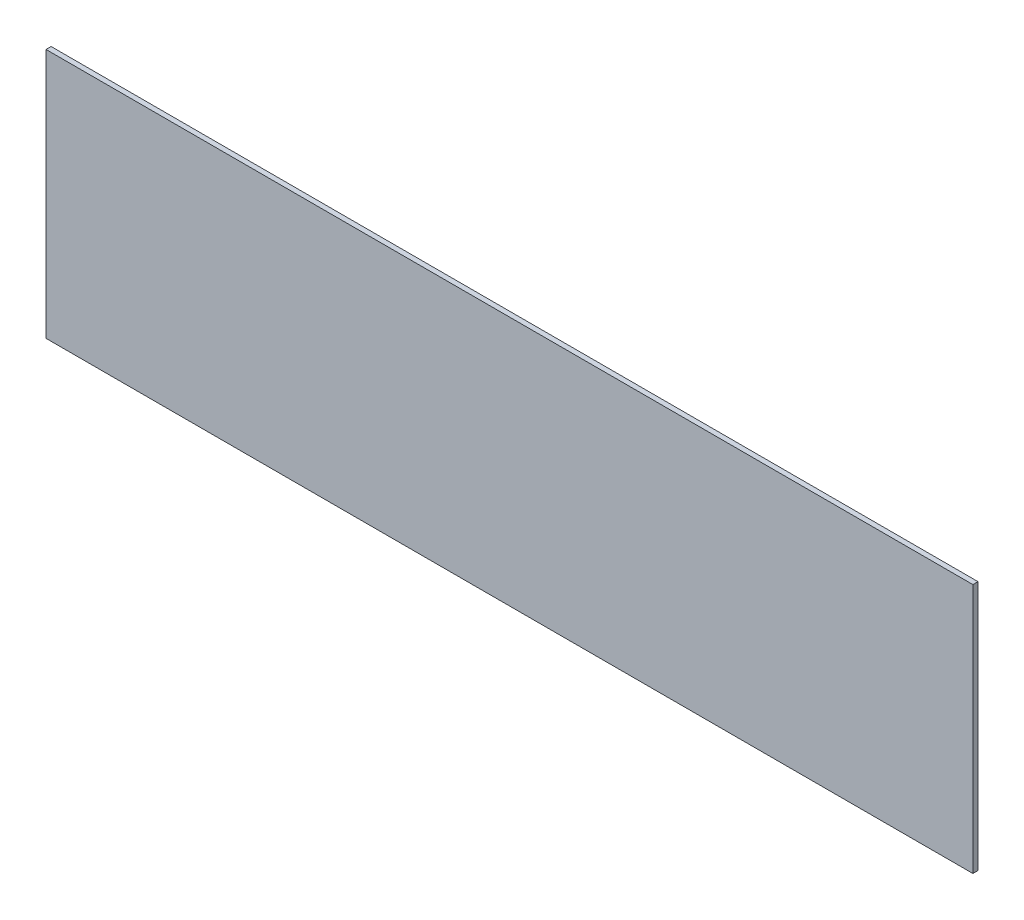
from build123d import *

# Parameters (mm, degrees)
SKETCH1_W           = 181.51
SKETCH1_H           = 49
BOSS_EXTRUDE1_DEPTH = 1


with BuildPart() as part:
    # Sketch1 → Boss-Extrude1 (new body)
    with BuildSketch(Plane.XY):
        with Locations((90.755, 24.5)):
            Rectangle(SKETCH1_W, SKETCH1_H)
    extrude(amount=BOSS_EXTRUDE1_DEPTH)


solid = part.part
